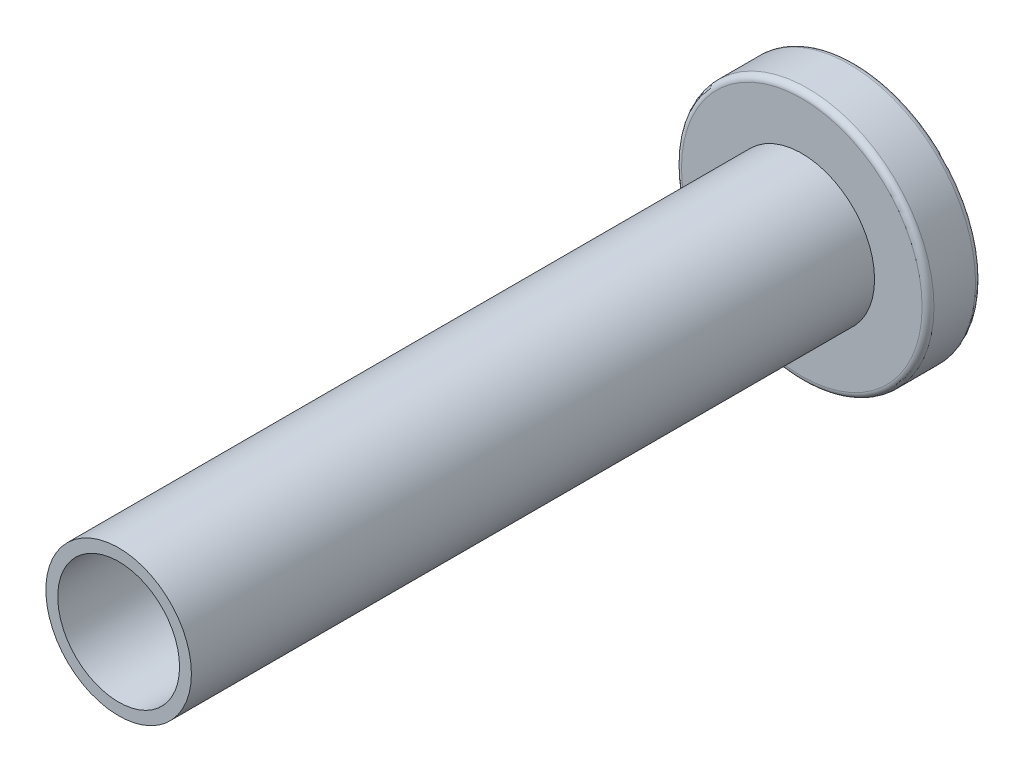
from build123d import *

# Parameters (mm, degrees)
SKETCH_1_R          = 4.25
EXTRUDE_1_DEPTH     = 1.8
SKETCH_2_R          = 2.45
SKETCH_2_R_2        = 2.05
EXTRUDE_2_DEPTH     = 23
FILLET_1_R          = 0.2
CUT_EXTRUDE_1_DEPTH = 1


with BuildPart() as part:
    # 草图1 → 凸台-拉伸1 (new body)
    with BuildSketch(Plane.XY):
        Circle(SKETCH_1_R)
    extrude(amount=EXTRUDE_1_DEPTH)

    # 草图2 → 凸台-拉伸2 (add)
    with BuildSketch(Plane.XY.offset(1.8)):
        Circle(SKETCH_2_R)
        Circle(SKETCH_2_R_2, mode=Mode.SUBTRACT)
    extrude(amount=EXTRUDE_2_DEPTH)

    # 圆角1
    fillet_1_edges = [part.edges().sort_by_distance(p)[0] for p in [
        (-4.25, 0, 0),
        (-4.25, 0, 1.8),
    ]]
    fillet(fillet_1_edges, radius=FILLET_1_R)

    # 草图3 → 切除-拉伸1 (cut)
    with BuildSketch(Plane(origin=(0, 0, 0), x_dir=(-1, 0, 0), z_dir=(0, 0, -1))):
        Polygon((1.443375673, 0), (0.721687836, 1.25), (-0.721687836, 1.25), (-1.443375673, 0), (-0.721687836, -1.25), (0.721687836, -1.25), align=None)
    extrude(amount=-CUT_EXTRUDE_1_DEPTH, mode=Mode.SUBTRACT)


solid = part.part
